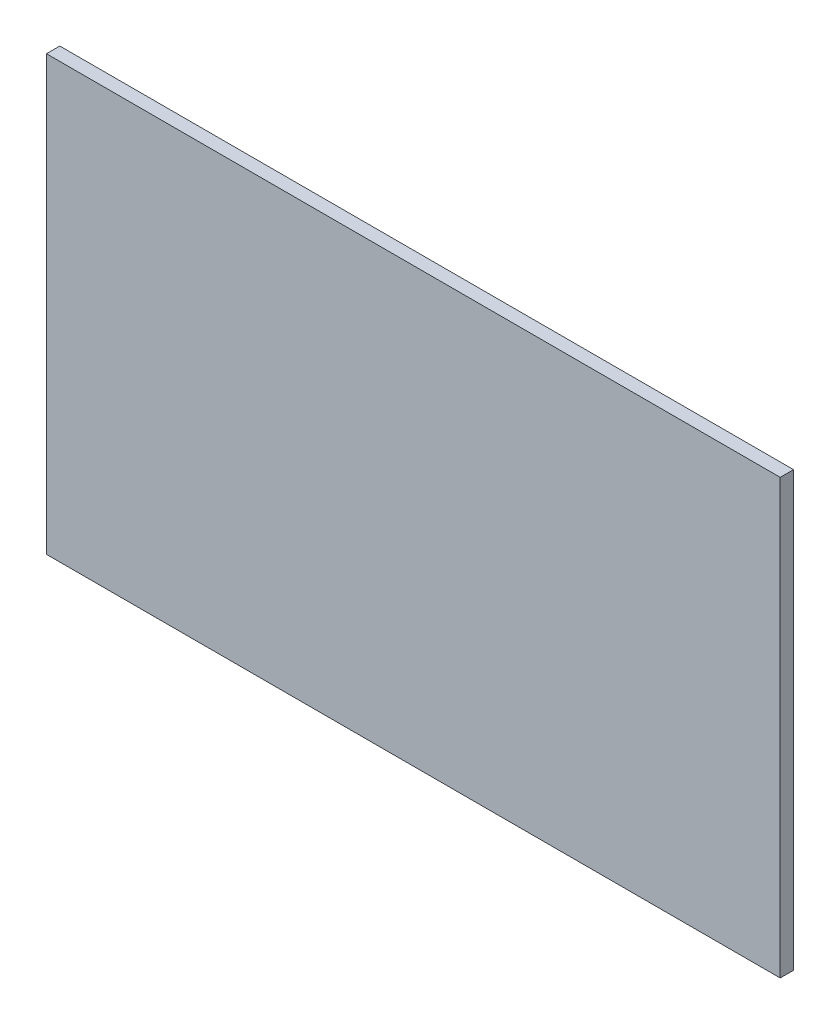
from build123d import *

# Parameters (mm, degrees)
SKETCH_1_W      = 2200
SKETCH_1_H      = 1300
EXTRUDE_1_DEPTH = 40


with BuildPart() as part:
    # Эскиз1 → Бобышка-Вытянуть1 (new body)
    with BuildSketch(Plane.XY):
        with Locations((346.977547496, 67.962003454)):
            Rectangle(SKETCH_1_W, SKETCH_1_H)
    extrude(amount=EXTRUDE_1_DEPTH)


solid = part.part
